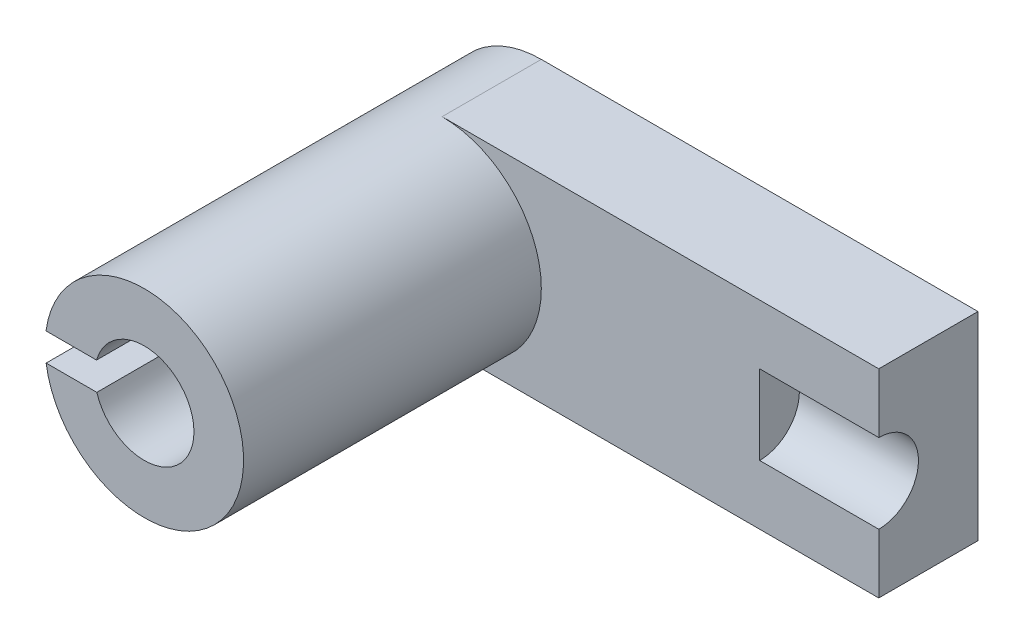
from build123d import *

# Parameters (mm, degrees)
BOSS_EXTRUDE1_DEPTH     = 110
CUT_EXTRUDE1_DEPTH      = 114.495594628
CUT_EXTRUDE1_DEPTH_BACK = 30
SKETCH5_R               = 25
SKETCH5_R_2             = 12.5
BOSS_EXTRUDE2_DEPTH     = 100
CUT_EXTRUDE2_DEPTH      = 170.852877515
CUT_EXTRUDE2_DEPTH_BACK = 170.852877515
SKETCH6_W               = 32.203850694
SKETCH6_H               = 7
CUT_EXTRUDE3_DEPTH      = 170.670177936
CUT_EXTRUDE3_DEPTH_BACK = 170.670177936
SKETCH7_R               = 12.5


with BuildPart() as part:
    # Sketch1 → Boss-Extrude1 (new body)
    with BuildSketch(Plane.YZ):
        with BuildLine():
            ThreePointArc((10, 12.5), (0, 2.5), (-10, 12.5))
            Line((-10, 12.5), (-25, 12.5))
            Line((-25, 12.5), (-25, -12.5))
            Line((-25, -12.5), (25, -12.5))
            Line((25, -12.5), (25, 12.5))
            Line((25, 12.5), (10, 12.5))
        make_face()
        with BuildLine():
            Line((10, 12.5), (-10, 12.5))
            ThreePointArc((-10, 12.5), (0, 2.5), (10, 12.5))
        make_face()
    extrude(amount=-BOSS_EXTRUDE1_DEPTH)

    # Sketch4 → Cut-Extrude1 (cut, two sides: drawn at the far end of the back side and taken through both)
    with BuildSketch(Plane.YZ.offset(-CUT_EXTRUDE1_DEPTH_BACK)):
        with BuildLine():
            Line((-10, 12.5), (10, 12.5))
            ThreePointArc((10, 12.5), (0, 2.5), (-10, 12.5))
        make_face()
    extrude(amount=CUT_EXTRUDE1_DEPTH + CUT_EXTRUDE1_DEPTH_BACK, mode=Mode.SUBTRACT)

    # Sketch5 → Boss-Extrude2 (add)
    with BuildSketch(Plane(origin=(0, 0, -12.5), x_dir=(1, 0, 0), z_dir=(0, 0, -1))):
        with Locations(Location((-110, 0, 0), (0, 0, 270))):
            Circle(SKETCH5_R)
        with Locations(Location((-110, 0, 0), (0, 0, 270))):
            Circle(SKETCH5_R_2, mode=Mode.SUBTRACT)
    extrude(amount=-BOSS_EXTRUDE2_DEPTH)

    # Sketch6 → Cut-Extrude2 (cut, two sides: drawn at the far end of the back side and taken through both)
    with BuildSketch(Plane.XY.offset(87.5).offset(-CUT_EXTRUDE2_DEPTH_BACK)):
        with Locations((-126.101925347, -0.117088635)):
            Rectangle(SKETCH6_W, SKETCH6_H)
    extrude(amount=CUT_EXTRUDE2_DEPTH + CUT_EXTRUDE2_DEPTH_BACK, mode=Mode.SUBTRACT)

    # Sketch7 → Cut-Extrude3 (cut, two sides: drawn at the far end of the back side and taken through both)
    with BuildSketch(Plane.XY.offset(87.5).offset(-CUT_EXTRUDE3_DEPTH_BACK)):
        with Locations((-110, 0)):
            Circle(SKETCH7_R)
    extrude(amount=CUT_EXTRUDE3_DEPTH + CUT_EXTRUDE3_DEPTH_BACK, mode=Mode.SUBTRACT)


solid = part.part
